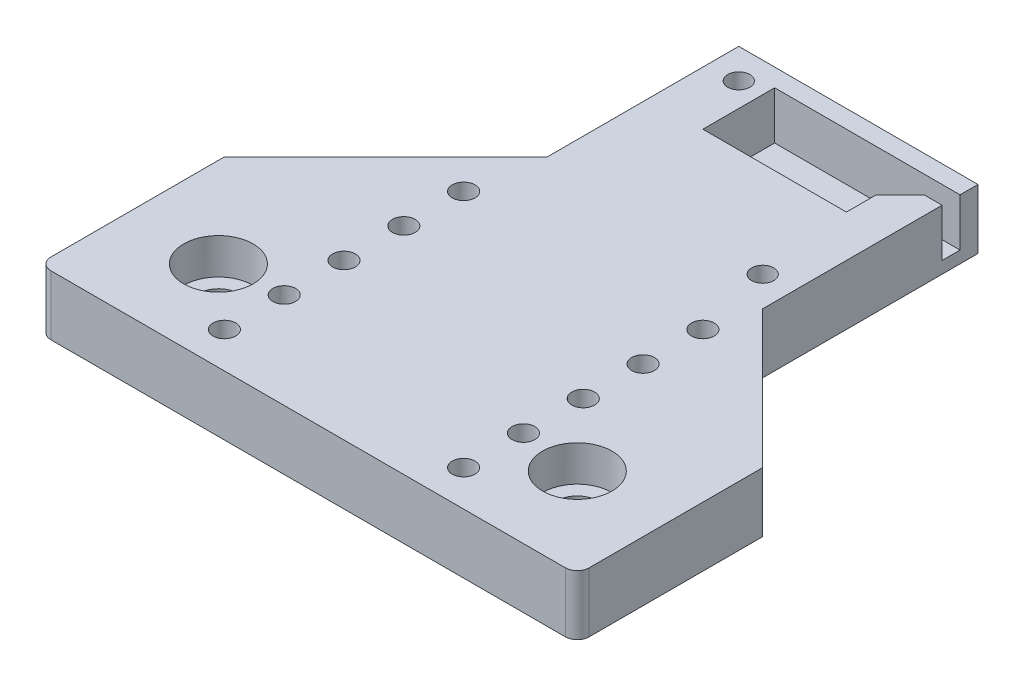
from build123d import *

# Parameters (mm, degrees)
SKETCH1_W           = 45
SKETCH1_H           = 45
SKETCH1_R           = 1.7
BOSS_EXTRUDE1_DEPTH = 5
SKETCH7_R           = 2.9
CUT_EXTRUDE6_DEPTH  = 3
SKETCH4_R           = 0.925
CUT_EXTRUDE3_DEPTH  = 33.210246817
SKETCH5_R           = 0.95
CUT_EXTRUDE4_DEPTH  = 33.210246817
LPATTERN1_COUNT     = 5
LPATTERN1_PITCH     = 5
FILLET1_R           = 1
CUT_EXTRUDE7_START  = -4
CUT_EXTRUDE7_DEPTH  = 4
FILLET2_R           = 3
CHAMFER2_SIZE       = 2
CUT_EXTRUDE8_DEPTH  = 33.210246817


with BuildPart() as part:
    # Sketch1 → Boss-Extrude1 (new body)
    with BuildSketch(Plane(origin=(0, 0, 0), x_dir=(1, 0, 0), z_dir=(0, 1, 0))):
        Rectangle(SKETCH1_W, SKETCH1_H)
        with Locations(Location((-15, 15, 0), (0, 0, 270))):
            Circle(SKETCH1_R, mode=Mode.SUBTRACT)
        with Locations(Location((-15, -15, 0), (0, 0, 270))):
            Circle(SKETCH1_R, mode=Mode.SUBTRACT)
        with Locations(Location((15, -15, 0), (0, 0, 90))):
            Circle(SKETCH1_R, mode=Mode.SUBTRACT)
        with Locations(Location((15, 15, 0), (0, 0, 90))):
            Circle(SKETCH1_R, mode=Mode.SUBTRACT)
    extrude(amount=BOSS_EXTRUDE1_DEPTH)

    # Sketch7 → Cut-Extrude6 (cut)
    with BuildSketch(Plane(origin=(0, 5, 0), x_dir=(1, 0, 0), z_dir=(0, 1, 0))):
        with Locations(Location((-15, 15, 0), (0, 0, 270))):
            Circle(SKETCH7_R)
        with Locations(Location((15, 15, 0), (0, 0, 270))):
            Circle(SKETCH7_R)
        with Locations(Location((-15, -15, 0), (0, 0, 270))):
            Circle(SKETCH7_R)
        with Locations(Location((15, -15, 0), (0, 0, 270))):
            Circle(SKETCH7_R)
    extrude(amount=-CUT_EXTRUDE6_DEPTH, mode=Mode.SUBTRACT)

    # Sketch4 → Cut-Extrude3 (cut, through all)
    with BuildSketch(Plane(origin=(0, 5, 0), x_dir=(1, 0, 0), z_dir=(0, 1, 0))):
        with Locations(Location((-6.5, 20, 0), (0, 0, 270))):
            Circle(SKETCH4_R)
        with Locations(Location((8.5, 7, 0), (0, 0, 270))):
            Circle(SKETCH4_R)
    extrude(amount=-CUT_EXTRUDE3_DEPTH, mode=Mode.SUBTRACT)

    # Sketch5 → Cut-Extrude4 (cut, through all)
    with BuildSketch(Plane(origin=(0, 5, 0), x_dir=(1, 0, 0), z_dir=(0, 1, 0))):
        with Locations(Location((-10, -19.5, 0), (0, 0, 270))):
            Circle(SKETCH5_R)
        with Locations(Location((10, -19.5, 0), (0, 0, 90))):
            Circle(SKETCH5_R)
    cut_extrude4 = extrude(amount=-CUT_EXTRUDE4_DEPTH, mode=Mode.SUBTRACT)

    # LPattern1: Cut-Extrude4 ×5
    with Locations(*[(0, 0, -i * LPATTERN1_PITCH) for i in range(1, LPATTERN1_COUNT)]):
        add(cut_extrude4, mode=Mode.SUBTRACT)

    # Fillet1
    fillet1_edges = [part.edges().sort_by_distance(p)[0] for p in [
        (22.5, 2.5, 22.5),
        (-22.5, 2.5, 22.5),
        (-22.5, 2.5, -22.5),
        (22.5, 2.5, -22.5),
    ]]
    fillet(fillet1_edges, radius=FILLET1_R)

    # Sketch8 → Cut-Extrude7 (cut)
    with BuildSketch(Plane(origin=(0, 5, 0), x_dir=(1, 0, 0), z_dir=(0, 1, 0)).offset(CUT_EXTRUDE7_START)):
        Polygon((-4.5, 21), (7.5, 21), (15.5, 21), (15.5, 19.5), (7.5, 19.5), (7.5, 15), (-4.5, 15), align=None)
    extrude(amount=CUT_EXTRUDE7_DEPTH, mode=Mode.SUBTRACT)

    # Fillet2
    fillet2_edges = [part.edges().sort_by_distance(p)[0] for p in [
        (15.5, 1, -20.25),
    ]]
    fillet(fillet2_edges, radius=FILLET2_R)

    # Chamfer2
    chamfer2_edges = [part.edges().sort_by_distance(p)[0] for p in [
        (7.5, 3, -19.5),
    ]]
    chamfer(chamfer2_edges, length=CHAMFER2_SIZE)

    # Sketch9 → Cut-Extrude8 (cut, through all)
    with BuildSketch(Plane(origin=(0, 5, 0), x_dir=(1, 0, 0), z_dir=(0, 1, 0))):
        with BuildLine():
            Line((-9, 22.5), (-9, 6.5))
            Line((-9, 6.5), (-22.5, -7))
            Line((-22.5, -7), (-22.5, 21.5))
            ThreePointArc((-22.5, 21.5), (-22.207106781, 22.207106781), (-21.5, 22.5))
            Line((-21.5, 22.5), (-9, 22.5))
        make_face()
        with BuildLine():
            Line((21.5, 22.5), (11, 22.5))
            Line((11, 22.5), (11, 4.5))
            Line((11, 4.5), (22.5, -7))
            Line((22.5, -7), (22.5, 21.5))
            ThreePointArc((22.5, 21.5), (22.207106781, 22.207106781), (21.5, 22.5))
        make_face()
    extrude(amount=-CUT_EXTRUDE8_DEPTH, mode=Mode.SUBTRACT)


solid = part.part
